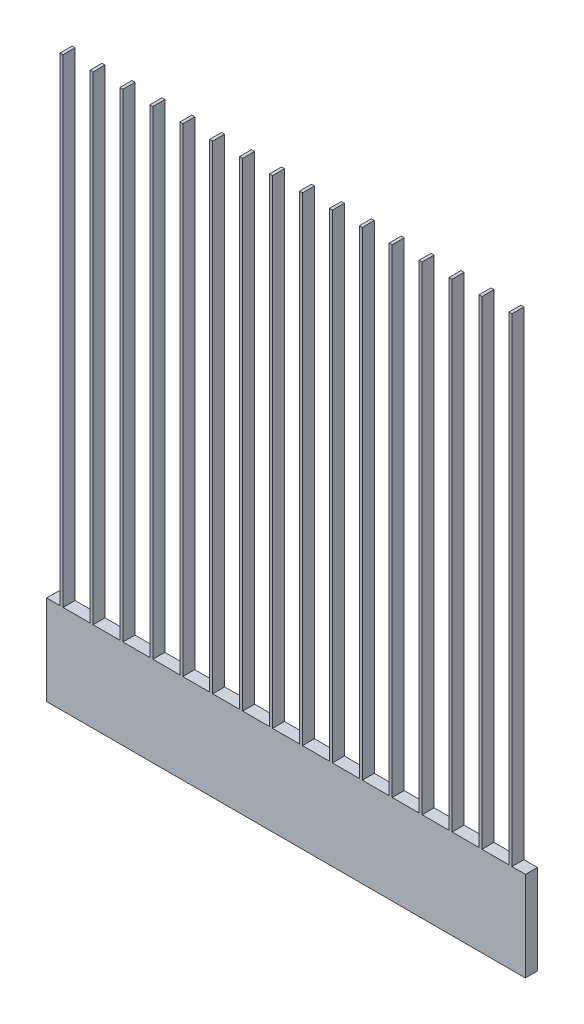
from build123d import *

# Parameters (mm, degrees)
SKETCH1_W           = 1.5
SKETCH1_H           = 8
BOSS_EXTRUDE1_DEPTH = 0.5
SKETCH2_W           = 0.05
SKETCH2_H           = 0.5
BOSS_EXTRUDE2_DEPTH = 8
SKETCH3_W           = 8
SKETCH3_H           = 0.3
CUT_EXTRUDE1_DEPTH  = 14.095800854


with BuildPart() as part:
    # Sketch1 → Boss-Extrude1 (new body)
    with BuildSketch(Plane(origin=(0, 0, 0), x_dir=(0, 1, 0), z_dir=(0, 0, 1))):
        with Locations((1.25, -5)):
            Rectangle(SKETCH1_W, SKETCH1_H)
    extrude(amount=BOSS_EXTRUDE1_DEPTH)

    # Sketch2 → Boss-Extrude2 (add)
    with BuildSketch(Plane(origin=(0, 2, 0), x_dir=(-1, 0, 0), z_dir=(0, 1, 0))):
        with Locations((-8.75, 0.25)):
            Rectangle(SKETCH2_W, SKETCH2_H)
        with Locations((-8.25, 0.25)):
            Rectangle(SKETCH2_W, SKETCH2_H)
        with Locations((-7.75, 0.25)):
            Rectangle(SKETCH2_W, SKETCH2_H)
        with Locations((-7.25, 0.25)):
            Rectangle(SKETCH2_W, SKETCH2_H)
        with Locations((-6.75, 0.25)):
            Rectangle(SKETCH2_W, SKETCH2_H)
        with Locations((-6.25, 0.25)):
            Rectangle(SKETCH2_W, SKETCH2_H)
        with Locations((-5.75, 0.25)):
            Rectangle(SKETCH2_W, SKETCH2_H)
        with Locations((-5.25, 0.25)):
            Rectangle(SKETCH2_W, SKETCH2_H)
        with Locations((-4.75, 0.25)):
            Rectangle(SKETCH2_W, SKETCH2_H)
        with Locations((-4.25, 0.25)):
            Rectangle(SKETCH2_W, SKETCH2_H)
        with Locations((-3.75, 0.25)):
            Rectangle(SKETCH2_W, SKETCH2_H)
        with Locations((-3.25, 0.25)):
            Rectangle(SKETCH2_W, SKETCH2_H)
        with Locations((-2.75, 0.25)):
            Rectangle(SKETCH2_W, SKETCH2_H)
        with Locations((-2.25, 0.25)):
            Rectangle(SKETCH2_W, SKETCH2_H)
        with Locations((-1.75, 0.25)):
            Rectangle(SKETCH2_W, SKETCH2_H)
        with Locations((-1.25, 0.25)):
            Rectangle(SKETCH2_W, SKETCH2_H)
    extrude(amount=BOSS_EXTRUDE2_DEPTH)

    # Sketch3 → Cut-Extrude1 (cut, through all)
    with BuildSketch(Plane.XZ.offset(-0.5)):
        with Locations((5, 0.15)):
            Rectangle(SKETCH3_W, SKETCH3_H)
    extrude(amount=-CUT_EXTRUDE1_DEPTH, mode=Mode.SUBTRACT)


solid = part.part
